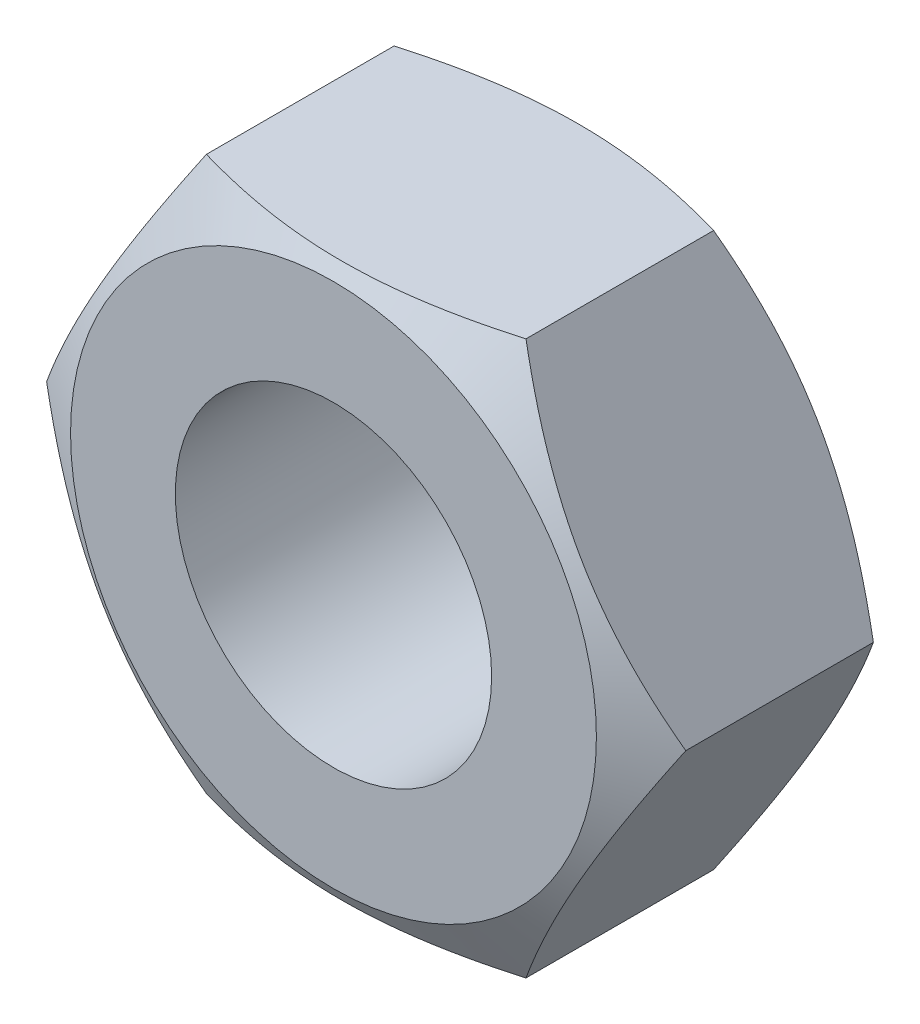
from build123d import *

# Parameters (mm, degrees)
BASENUTSKE_R            = 2
BASENUT_DEPTH           = 3.2
SKETCH6_OUTSIDE_W       = 37.362
SKETCH6_OUTSIDE_H       = 36.28
SKETCH6_OUTSIDE_R       = 3.325
CUT_EXTRUDE2_DEPTH      = 7.23083729
CUT_EXTRUDE2_DRAFT      = -60
MIRROR1_COPY_1_SKETCH_W = 37.362
MIRROR1_COPY_1_SKETCH_H = 36.28
MIRROR1_COPY_1_SKETCH_R = 3.325
MIRROR1_COPY_1_DEPTH    = 7.23083729
MIRROR1_COPY_1_DRAFT    = -60


with BuildPart() as part:
    # BaseNutSke → BaseNut (new body)
    with BuildSketch(Plane.XY):
        Polygon((2.020725942, -3.5), (-2.020725942, -3.5), (-4.041451884, 0), (-2.020725942, 3.5), (2.020725942, 3.5), (4.041451884, 0), align=None)
        Circle(BASENUTSKE_R, mode=Mode.SUBTRACT)
    extrude(amount=-BASENUT_DEPTH)


with BuildPart() as cut_extrude2_tool:
    # Sketch6 outside → Cut-Extrude2 (with draft: the straight prism first)
    with BuildSketch(Plane(origin=(0, 0, -3.2), x_dir=(-1, 0, 0), z_dir=(0, 0, -1))):
        Rectangle(SKETCH6_OUTSIDE_W, SKETCH6_OUTSIDE_H)
        Circle(SKETCH6_OUTSIDE_R, mode=Mode.SUBTRACT)
    extrude(amount=-CUT_EXTRUDE2_DEPTH)
    # Cut-Extrude2: the draft: its side faces are tilted about the plane it starts from
    cut_extrude2_sides = [cut_extrude2_tool.faces().sort_by_distance(p)[0] for p in [
        (0, -18.14, 0.415418645),
        (-18.681, 0, 0.415418645),
        (0, 18.14, 0.415418645),
        (18.681, 0, 0.415418645),
        (3.325, 0, 0.415418645),
    ]]
    draft(cut_extrude2_sides, Plane(origin=(0, 0, -3.2), x_dir=(-1, 0, 0), z_dir=(0, 0, -1)), CUT_EXTRUDE2_DRAFT)


with BuildPart() as part_1:
    add(part.part)

    # Cut-Extrude2: cut by cut_extrude2_tool
    add(cut_extrude2_tool.part, mode=Mode.SUBTRACT)


with BuildPart() as mirror1_copy_1_tool:
    # Mirror1 copy 1 sketch → Mirror1 copy 1 (with draft: the straight prism first)
    with BuildSketch(Plane(origin=(0, 0, 0), x_dir=(-1, 0, 0), z_dir=(0, 0, 1))):
        Rectangle(MIRROR1_COPY_1_SKETCH_W, MIRROR1_COPY_1_SKETCH_H)
        Circle(MIRROR1_COPY_1_SKETCH_R, mode=Mode.SUBTRACT)
    extrude(amount=-MIRROR1_COPY_1_DEPTH)
    # Mirror1 copy 1: the draft: its side faces are tilted about the plane it starts from
    mirror1_copy_1_sides = [mirror1_copy_1_tool.faces().sort_by_distance(p)[0] for p in [
        (0, -18.14, -3.615418645),
        (-18.681, 0, -3.615418645),
        (0, 18.14, -3.615418645),
        (18.681, 0, -3.615418645),
        (3.325, 0, -3.615418645),
    ]]
    draft(mirror1_copy_1_sides, Plane(origin=(0, 0, 0), x_dir=(-1, 0, 0), z_dir=(0, 0, 1)), MIRROR1_COPY_1_DRAFT)


with BuildPart() as part_2:
    add(part_1.part)

    # Mirror1 copy 1: cut by mirror1_copy_1_tool
    add(mirror1_copy_1_tool.part, mode=Mode.SUBTRACT)


solid = part_2.part
